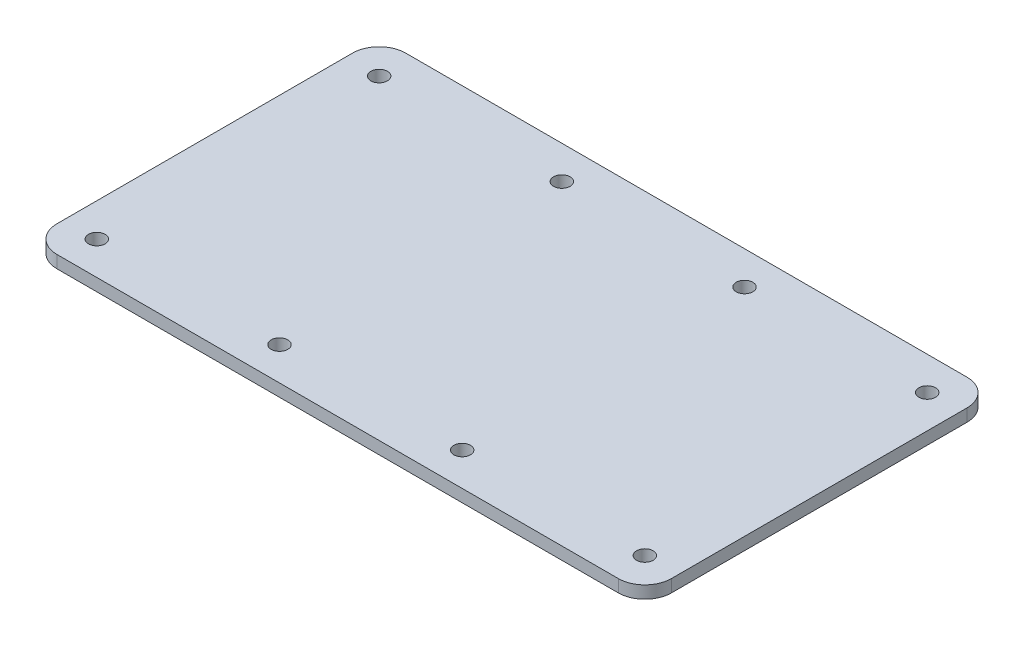
from build123d import *

# Parameters (mm, degrees)
SKETCH1_W                   = 234.95
SKETCH1_H                   = 133.35
BOSS_EXTRUDE1_DEPTH         = 4.7625
FILLET1_R                   = 10.16
F_1_4_0_25_DIAMETER_HOLE3_D = 6.35


with BuildPart() as part:
    # Sketch1 → Boss-Extrude1 (new body)
    with BuildSketch(Plane(origin=(0, 0, 0), x_dir=(1, 0, 0), z_dir=(0, 1, 0))):
        with Locations((117.475, 66.675)):
            Rectangle(SKETCH1_W, SKETCH1_H)
    extrude(amount=BOSS_EXTRUDE1_DEPTH)

    # Fillet1
    fillet1_edges = [part.edges().sort_by_distance(p)[0] for p in [
        (0, 2.38125, -133.35),
        (234.95, 2.38125, -133.35),
        (234.95, 2.38125, 0),
        (0, 2.38125, 0),
    ]]
    fillet(fillet1_edges, radius=FILLET1_R)

    # 1/4 (0.25) Diameter Hole3 (through all)
    with Locations(Plane(origin=(0, 4.7625, 0), x_dir=(1, 0, 0), z_dir=(0, 1, 0))):
        with Locations((12.7, 120.65), (82.55, 120.65), (152.4, 120.65), (222.25, 120.65)):
            f_1_4_0_25_diameter_hole3 = Hole(F_1_4_0_25_DIAMETER_HOLE3_D / 2)

    # Mirror1: 1/4 (0.25) Diameter Hole3 across plane
    add(f_1_4_0_25_diameter_hole3.mirror(Plane.XY.offset(-66.675)), mode=Mode.SUBTRACT)


solid = part.part
